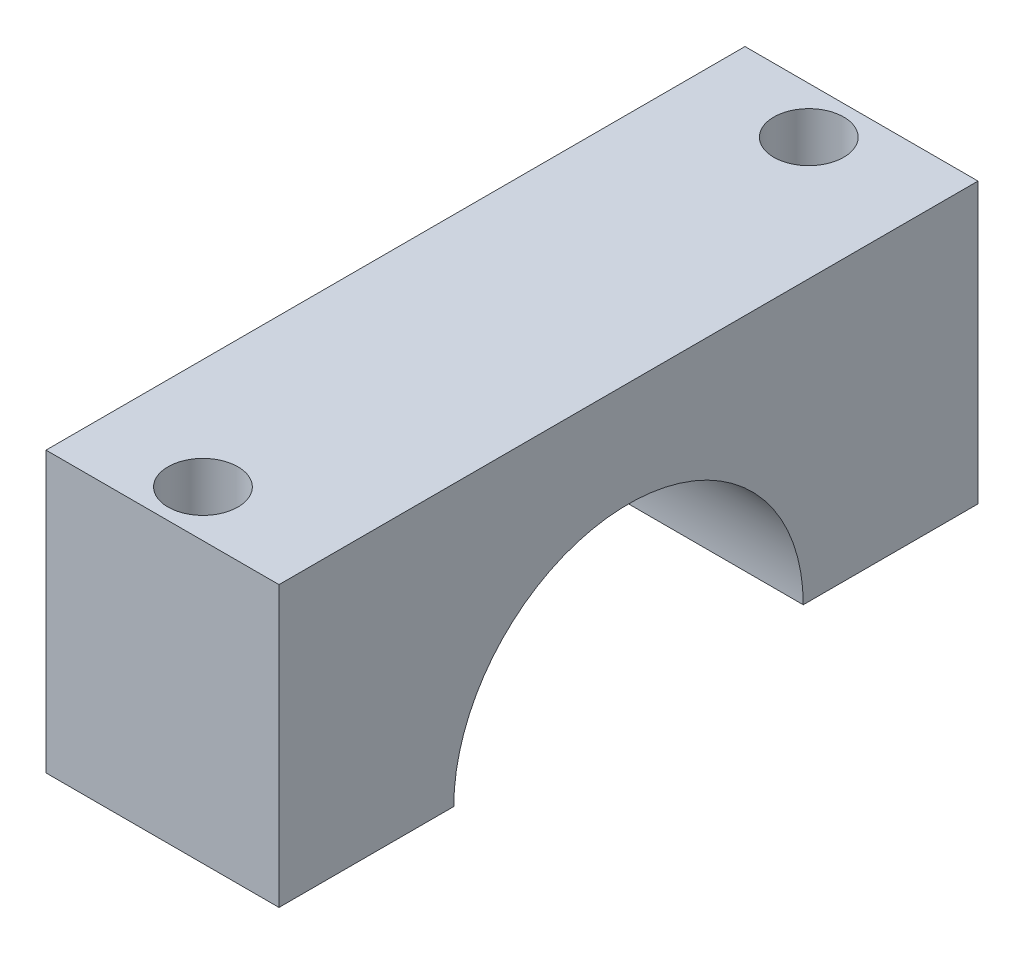
from build123d import *

# Parameters (mm, degrees)
BOSS_EXTRUDE1_DEPTH = 20
SKETCH7_R           = 15
CUT_EXTRUDE1_DEPTH  = 20
SKETCH6_R           = 3
CUT_EXTRUDE2_DEPTH  = 24


with BuildPart() as part:
    # Sketch1 → Boss-Extrude1 (new body)
    with BuildSketch(Plane(origin=(0, 0, 0), x_dir=(0, 0, -1), z_dir=(1, 0, 0))):
        Polygon((0, 0), (-30, 0), (-30, 24), (30, 24), (30, 0), align=None)
    extrude(amount=-BOSS_EXTRUDE1_DEPTH)

    # Sketch7 → Cut-Extrude1 (cut)
    with BuildSketch(Plane.ZY.offset(20)):
        Circle(SKETCH7_R)
    extrude(amount=-CUT_EXTRUDE1_DEPTH, mode=Mode.SUBTRACT)

    # Sketch6 → Cut-Extrude2 (cut)
    with BuildSketch(Plane(origin=(0, 24, 0), x_dir=(1, 0, 0), z_dir=(0, 1, 0))):
        with Locations(Location((-10.527062393, 26, 0), (0, 0, 270))):
            Circle(SKETCH6_R)
        with Locations(Location((-10.527062393, -26, 0), (0, 0, 270))):
            Circle(SKETCH6_R)
    extrude(amount=-CUT_EXTRUDE2_DEPTH, mode=Mode.SUBTRACT)


solid = part.part
